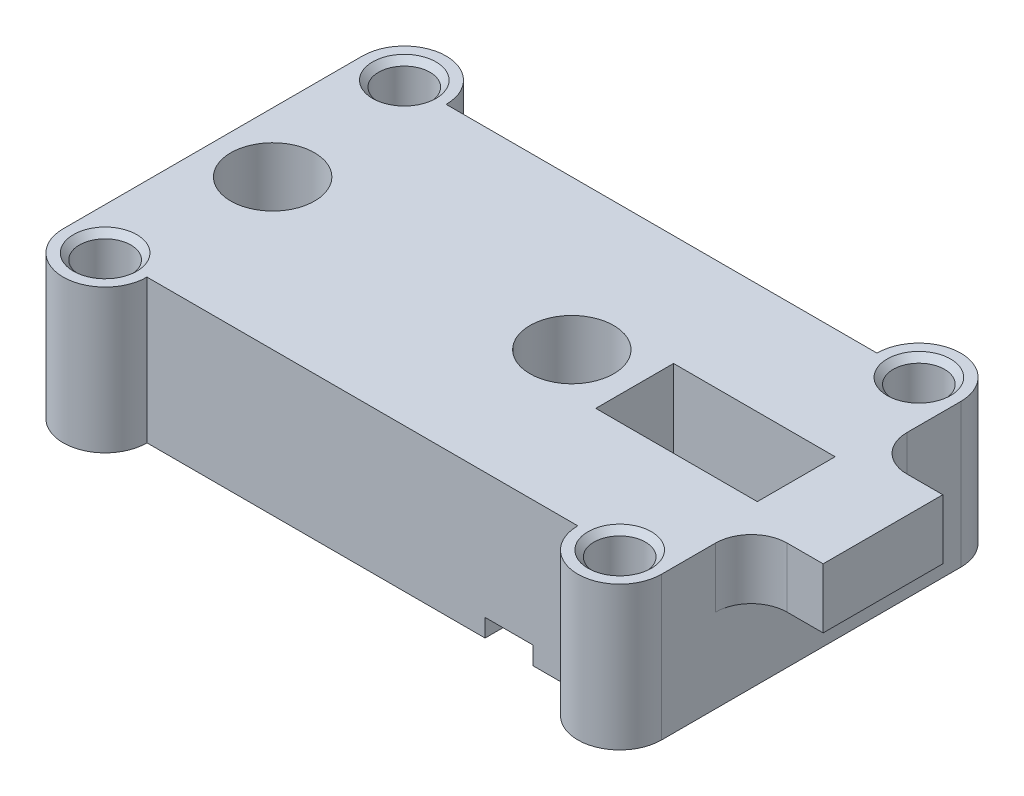
from build123d import *

# Parameters (mm, degrees)
SKETCH2_W           = 13.5
SKETCH2_H           = 3.5
SKETCH2_R           = 1.75
BOSS_EXTRUDE2_DEPTH = 12
BOSS_EXTRUDE3_START = 12
SKETCH2_4_W         = 6
SKETCH2_4_H         = 10
BOSS_EXTRUDE3_DEPTH = 5
CUT_EXTRUDE1_START  = 12
SKETCH2_6_W         = 13.5
SKETCH2_6_H         = 1.5
CUT_EXTRUDE1_DEPTH  = 9.3
CUT_EXTRUDE2_START  = 12
CUT_EXTRUDE2_DEPTH  = 4.5
CUT_EXTRUDE3_START  = 3.5
SKETCH2_8_R         = 3.5
SKETCH2_8_R_2       = 1.75
CUT_EXTRUDE3_DEPTH  = 8.5
FILLET1_R           = 3
CHAMFER1_SIZE       = 0.5
CUT_EXTRUDE4_DEPTH  = 1.5


with BuildPart() as part:
    # Sketch2 → Boss-Extrude2 (new body)
    with BuildSketch(Plane(origin=(0, 0, 0), x_dir=(1, 0, 0), z_dir=(0, 1, 0))):
        with BuildLine():
            Line((-18, -12.5), (18, -12.5))
            ThreePointArc((18, -12.5), (21.5, -16), (25, -12.5))
            Line((25, -12.5), (25, 12.5))
            ThreePointArc((25, 12.5), (21.5, 16), (18, 12.5))
            Line((18, 12.5), (-18, 12.5))
            ThreePointArc((-18, 12.5), (-21.5, 16), (-25, 12.5))
            Line((-25, 12.5), (-25, -12.5))
            ThreePointArc((-25, -12.5), (-21.5, -16), (-18, -12.5))
        make_face()
        with Locations((17, 0)):
            Rectangle(SKETCH2_W, SKETCH2_H, mode=Mode.SUBTRACT)
        with Locations(Location((-20, 0, 0), (0, 0, 270))):
            Circle(SKETCH2_R, mode=Mode.SUBTRACT)
        with Locations(Location((5, 0, 0), (0, 0, 270))):
            Circle(SKETCH2_R, mode=Mode.SUBTRACT)
    extrude(amount=BOSS_EXTRUDE2_DEPTH)

    # Sketch2<4> → Boss-Extrude3 (add)
    with BuildSketch(Plane(origin=(0, 0, 0), x_dir=(1, 0, 0), z_dir=(0, 1, 0)).offset(BOSS_EXTRUDE3_START)):
        with Locations((28, 0)):
            Rectangle(SKETCH2_4_W, SKETCH2_4_H)
    extrude(amount=-BOSS_EXTRUDE3_DEPTH)

    # Sketch2<6> → Cut-Extrude1 (cut)
    with BuildSketch(Plane(origin=(0, 0, 0), x_dir=(1, 0, 0), z_dir=(0, 1, 0)).offset(CUT_EXTRUDE1_START)):
        with Locations((17, -2.5)):
            Rectangle(SKETCH2_6_W, SKETCH2_6_H)
        with Locations((17, 2.5)):
            Rectangle(SKETCH2_6_W, SKETCH2_6_H)
    extrude(amount=-CUT_EXTRUDE1_DEPTH, mode=Mode.SUBTRACT)

    # Sketch2<7> → Cut-Extrude2 (cut)
    with BuildSketch(Plane(origin=(0, 0, 0), x_dir=(1, 0, 0), z_dir=(0, 1, 0)).offset(CUT_EXTRUDE2_START)):
        with BuildLine():
            ThreePointArc((23.65, 12.5), (21.5, 14.65), (19.35, 12.5))
            Line((19.35, 12.5), (23.65, 12.5))
        make_face()
        with BuildLine():
            Line((23.65, 12.5), (19.35, 12.5))
            ThreePointArc((19.35, 12.5), (21.5, 10.35), (23.65, 12.5))
        make_face()
        with BuildLine():
            ThreePointArc((23.65, -12.5), (21.5, -10.35), (19.35, -12.5))
            Line((19.35, -12.5), (23.65, -12.5))
        make_face()
        with BuildLine():
            Line((23.65, -12.5), (19.35, -12.5))
            ThreePointArc((19.35, -12.5), (21.5, -14.65), (23.65, -12.5))
        make_face()
        with BuildLine():
            ThreePointArc((-19.35, 12.5), (-21.5, 14.65), (-23.65, 12.5))
            Line((-23.65, 12.5), (-19.35, 12.5))
        make_face()
        with BuildLine():
            Line((-19.35, 12.5), (-23.65, 12.5))
            ThreePointArc((-23.65, 12.5), (-21.5, 10.35), (-19.35, 12.5))
        make_face()
        with BuildLine():
            ThreePointArc((-23.65, -12.5), (-21.5, -14.65), (-19.35, -12.5))
            Line((-19.35, -12.5), (-23.65, -12.5))
        make_face()
        with BuildLine():
            Line((-23.65, -12.5), (-19.35, -12.5))
            ThreePointArc((-19.35, -12.5), (-21.5, -10.35), (-23.65, -12.5))
        make_face()
    extrude(amount=-CUT_EXTRUDE2_DEPTH, mode=Mode.SUBTRACT)

    # Sketch2<8> → Cut-Extrude3 (cut)
    # profile 1 of 2: a face of its own
    with BuildSketch(Plane(origin=(0, 0, 0), x_dir=(1, 0, 0), z_dir=(0, 1, 0)).offset(CUT_EXTRUDE3_START)):
        with Locations(Location((-20, 0, 0), (0, 0, 270))):
            Circle(SKETCH2_8_R)
        with Locations(Location((-20, 0, 0), (0, 0, 270))):
            Circle(SKETCH2_8_R_2, mode=Mode.SUBTRACT)
    # profile 2 of 2: a face of its own
    with BuildSketch(Plane(origin=(0, 0, 0), x_dir=(1, 0, 0), z_dir=(0, 1, 0)).offset(CUT_EXTRUDE3_START)):
        with Locations(Location((5, 0, 0), (0, 0, 270))):
            Circle(SKETCH2_8_R)
        with Locations(Location((5, 0, 0), (0, 0, 270))):
            Circle(SKETCH2_8_R_2, mode=Mode.SUBTRACT)
    extrude(amount=CUT_EXTRUDE3_DEPTH, mode=Mode.SUBTRACT)

    # Fillet1
    fillet1_edges = [part.edges().sort_by_distance(p)[0] for p in [
        (25, 9.5, -5),
        (25, 9.5, 5),
    ]]
    fillet(fillet1_edges, radius=FILLET1_R)

    # Chamfer1
    chamfer1_edges = [part.edges().sort_by_distance(p)[0] for p in [
        (19.35, 12, 12.5),
        (-23.65, 12, -12.5),
        (-19.35, 12, 12.5),
        (19.35, 12, -12.5),
    ]]
    chamfer(chamfer1_edges, length=CHAMFER1_SIZE)

    # Sketch3 → Cut-Extrude4 (cut)
    with BuildSketch(Plane.XZ):
        Polygon((10.25, 1.75), (10.25, 12.5), (14.25, 12.5), (23.75, 1.75), align=None)
    extrude(amount=-CUT_EXTRUDE4_DEPTH, mode=Mode.SUBTRACT)


solid = part.part
